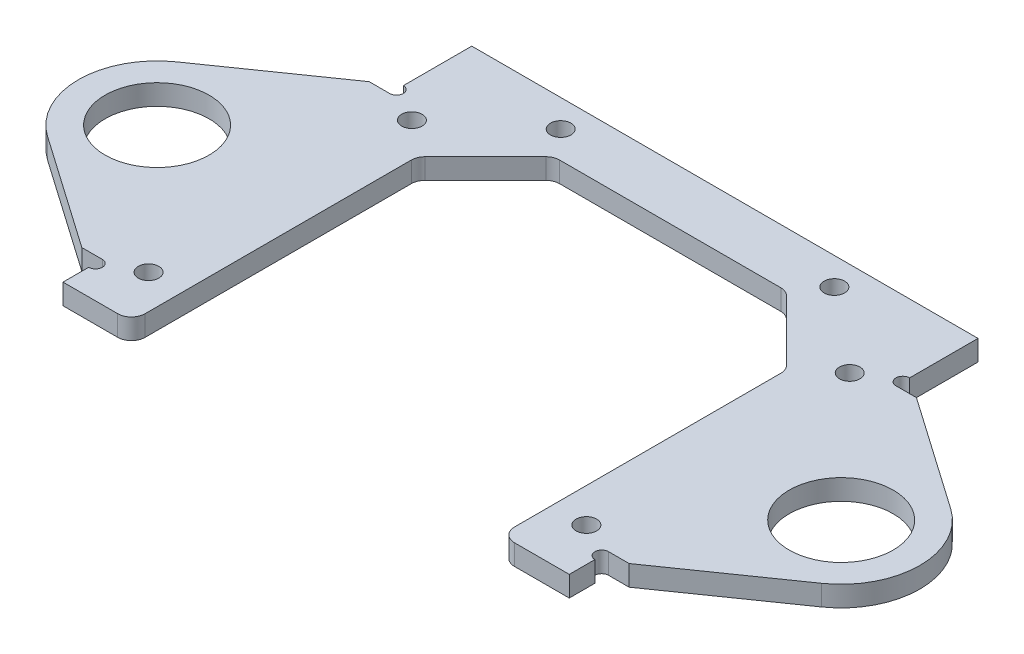
from build123d import *

# Parameters (mm, degrees)
SKETCH_1_R          = 7.6
SKETCH_1_R_2        = 1.5
EXTRUDE_1_DEPTH     = 3
SKETCH_2_R          = 1
CUT_EXTRUDE_1_DEPTH = 70.858786133
CUT_EXTRUDE_2_DEPTH = 70.858786133
CHAMFER_1_SIZE      = 10
FILLET_2_R          = 2


with BuildPart() as part:
    # 草图1 → 凸台-拉伸1 (new body)
    with BuildSketch(Plane(origin=(0, 0, 0), x_dir=(1, 0, 0), z_dir=(0, 1, 0))):
        with BuildLine():
            Line((-37, 33), (-37, 21))
            Line((-37, 21), (-40, 21))
            Line((-40, 21), (-56.580484914, 9.431183292))
            ThreePointArc((-56.580484914, 9.431183292), (-61.5, 0), (-56.580484914, -9.431183292))
            Line((-56.580484914, -9.431183292), (-40, -21))
            Line((-40, -21), (-37, -21))
            Line((-37, -21), (-37, -33))
            Line((-37, -33), (37, -33))
            Line((37, -33), (37, -21))
            Line((37, -21), (40, -21))
            Line((40, -21), (56.580484914, -9.431183292))
            ThreePointArc((56.580484914, -9.431183292), (61.5, 0), (56.580484914, 9.431183292))
            Line((56.580484914, 9.431183292), (40, 21))
            Line((40, 21), (37, 21))
            Line((37, 21), (37, 33))
            Line((37, 33), (-37, 33))
        make_face()
        with Locations(Location((-50, 0, 0), (0, 0, 270))):
            Circle(SKETCH_1_R, mode=Mode.SUBTRACT)
        with Locations(Location((50, 0, 0), (0, 0, 90))):
            Circle(SKETCH_1_R, mode=Mode.SUBTRACT)
        with Locations(Location((32, 19.25, 0), (0, 0, 90))):
            Circle(SKETCH_1_R_2, mode=Mode.SUBTRACT)
        with Locations(Location((32, -19.25, 0), (0, 0, 90))):
            Circle(SKETCH_1_R_2, mode=Mode.SUBTRACT)
        with Locations(Location((-32, -19.25, 0), (0, 0, 270))):
            Circle(SKETCH_1_R_2, mode=Mode.SUBTRACT)
        with Locations(Location((-32, 19.25, 0), (0, 0, 270))):
            Circle(SKETCH_1_R_2, mode=Mode.SUBTRACT)
        with Locations(Location((-20, 29, 0), (0, 0, 270))):
            Circle(SKETCH_1_R_2, mode=Mode.SUBTRACT)
        with Locations(Location((20, 29, 0), (0, 0, 90))):
            Circle(SKETCH_1_R_2, mode=Mode.SUBTRACT)
    extrude(amount=EXTRUDE_1_DEPTH)

    # 草图2 → 切除-拉伸1 (cut, through all)
    with BuildSketch(Plane(origin=(0, 3, 0), x_dir=(1, 0, 0), z_dir=(0, 1, 0))):
        with Locations((-37, 22)):
            Circle(SKETCH_2_R)
        with Locations((-37, -22)):
            Circle(SKETCH_2_R)
        with Locations((37, -22)):
            Circle(SKETCH_2_R)
        with Locations((37, 22)):
            Circle(SKETCH_2_R)
    extrude(amount=-CUT_EXTRUDE_1_DEPTH, mode=Mode.SUBTRACT)

    # 草图3 → 切除-拉伸2 (cut, through all)
    with BuildSketch(Plane(origin=(0, 3, 0), x_dir=(1, 0, 0), z_dir=(0, 1, 0))):
        Polygon((-27, -26.75), (-27, 25), (27, 25), (27, -26.75), (37, -26.75), (37, -33), (-37, -33), (-37, -26.75), align=None)
    extrude(amount=-CUT_EXTRUDE_2_DEPTH, mode=Mode.SUBTRACT)

    # 倒角1
    chamfer_1_edges = [part.edges().sort_by_distance(p)[0] for p in [
        (-27, 1.5, -25),
        (27, 1.5, -25),
    ]]
    chamfer(chamfer_1_edges, length=CHAMFER_1_SIZE)

    # 圆角2
    fillet_2_edges = [part.edges().sort_by_distance(p)[0] for p in [
        (-27, 1.5, 26.75),
        (27, 1.5, 26.75),
        (-17, 1.5, -25),
        (17, 1.5, -25),
        (27, 1.5, -15),
        (-27, 1.5, -15),
    ]]
    fillet(fillet_2_edges, radius=FILLET_2_R)


solid = part.part
